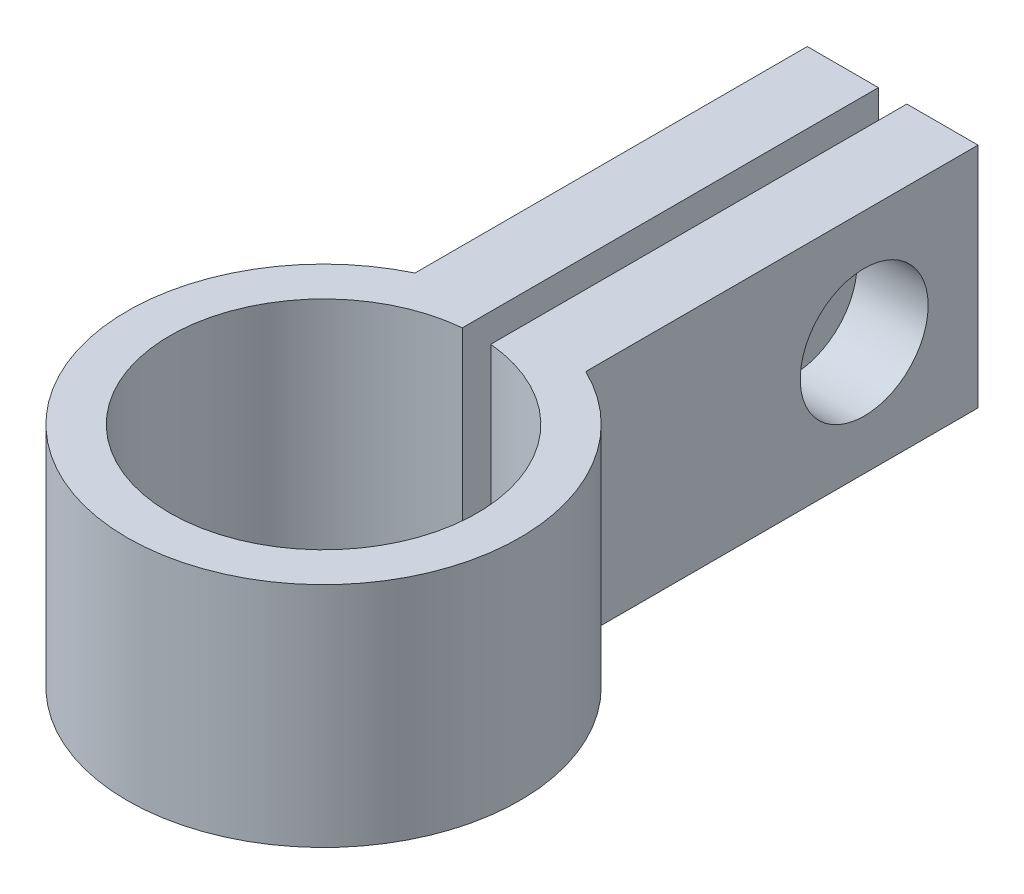
from build123d import *

# Parameters (mm, degrees)
BOSS_EXTRUDE1_DEPTH   = 8
F_8_CLEARANCE_HOLE1_D = 4.4958


with BuildPart() as part:
    # Sketch1 → Boss-Extrude1 (new body)
    with BuildSketch(Plane(origin=(0, 0, 0), x_dir=(1, 0, 0), z_dir=(0, 1, 0))):
        with BuildLine():
            Line((3, 6.213694553), (3, 20))
            Line((3, 20), (0.5, 20))
            Line((0.5, 20), (0.5, 5.376802024))
            ThreePointArc((0.5, 5.376802024), (0, -5.4), (-0.5, 5.376802024))
            Line((-0.5, 5.376802024), (-0.5, 20))
            Line((-0.5, 20), (-3, 20))
            Line((-3, 20), (-3, 6.213694553))
            ThreePointArc((-3, 6.213694553), (0, -6.9), (3, 6.213694553))
        make_face()
    extrude(amount=BOSS_EXTRUDE1_DEPTH)

    # #8 Clearance Hole1 (through all)
    with Locations(Plane(origin=(3, 0, 0), x_dir=(0, 0, -1), z_dir=(1, 0, 0))):
        with Locations((16, 4)):
            Hole(F_8_CLEARANCE_HOLE1_D / 2)


solid = part.part
